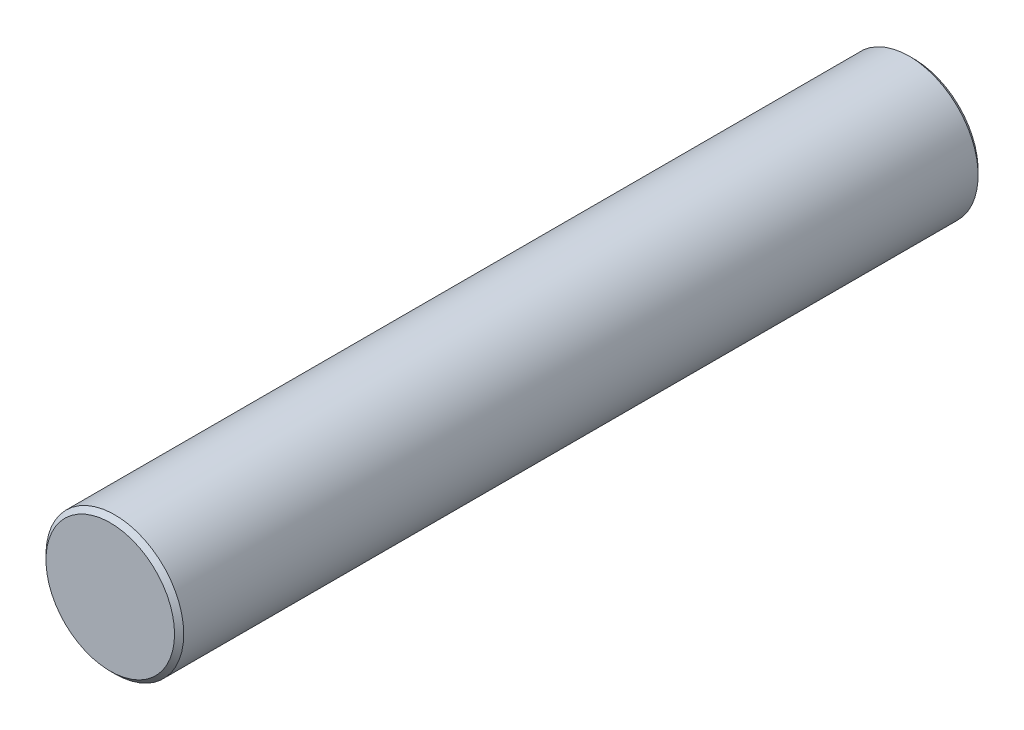
from build123d import *

# Parameters (mm, degrees)
SKETCH1_R           = 3
BOSS_EXTRUDE1_DEPTH = 35
SKETCH2_W           = 10
SKETCH2_H           = 6
CUT_EXTRUDE1_DEPTH  = 1
CHAMFER1_SIZE       = 0.2
SKETCH3_R           = 0.3
CUT_EXTRUDE2_DEPTH  = 0.4
CUT_EXTRUDE2_DRAFT  = -15


with BuildPart() as part:
    # Sketch1 → Boss-Extrude1 (new body)
    with BuildSketch(Plane.XY):
        Circle(SKETCH1_R)
    extrude(amount=BOSS_EXTRUDE1_DEPTH)

    # Sketch2 → Cut-Extrude1 (cut)
    with BuildSketch(Plane.ZY.offset(3)):
        with Locations((5, 0)):
            Rectangle(SKETCH2_W, SKETCH2_H)
    extrude(amount=-CUT_EXTRUDE1_DEPTH, mode=Mode.SUBTRACT)

    # Chamfer1
    chamfer1_edges = [part.edges().sort_by_distance(p)[0] for p in [
        (1.224744871, 2.738612788, 0),
        (-2, 0, 0),
        (-3, 0, 10),
        (-3, 0, 35),
    ]]
    chamfer(chamfer1_edges, length=CHAMFER1_SIZE)


with BuildPart() as cut_extrude2_tool:
    # Sketch3 → Cut-Extrude2 (with draft: the straight prism first)
    with BuildSketch(Plane(origin=(0, 0, 0), x_dir=(-1, 0, 0), z_dir=(0, 0, -1))):
        Circle(SKETCH3_R)
    extrude(amount=-CUT_EXTRUDE2_DEPTH)
    # Cut-Extrude2: the draft: its side faces are tilted about the plane it starts from
    cut_extrude2_sides = [cut_extrude2_tool.faces().sort_by_distance(p)[0] for p in [
        (0.3, 0, 0.2),
    ]]
    draft(cut_extrude2_sides, Plane(origin=(0, 0, 0), x_dir=(-1, 0, 0), z_dir=(0, 0, -1)), CUT_EXTRUDE2_DRAFT)


with BuildPart() as part_1:
    add(part.part)

    # Cut-Extrude2: cut by cut_extrude2_tool
    add(cut_extrude2_tool.part, mode=Mode.SUBTRACT)


solid = part_1.part
